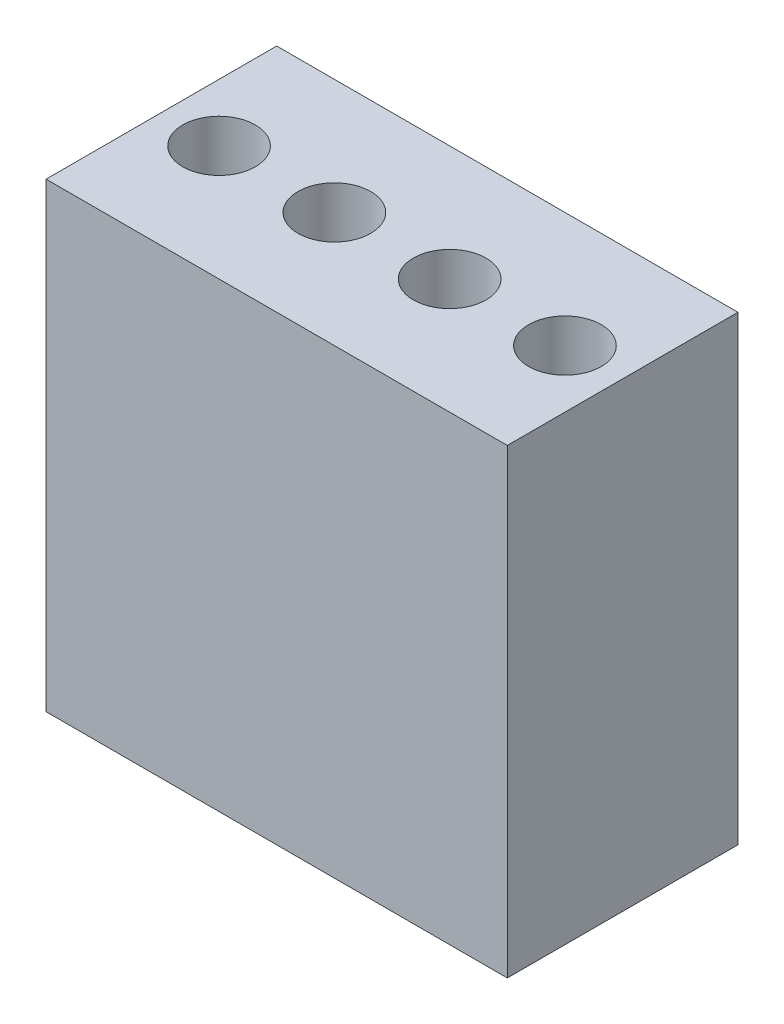
from build123d import *

# Parameters (mm, degrees)
SKETCH1_W           = 12.7
SKETCH1_H           = 6.35
SKETCH1_R           = 1
BOSS_EXTRUDE1_DEPTH = 12.7


with BuildPart() as part:
    # Sketch1 → Boss-Extrude1 (new body)
    with BuildSketch(Plane(origin=(0, 0, 0), x_dir=(1, 0, 0), z_dir=(0, 1, 0))):
        with Locations((6.35, 3.175)):
            Rectangle(SKETCH1_W, SKETCH1_H)
        with Locations(Location((1.5875, 3.175, 0), (0, 0, 270))):
            Circle(SKETCH1_R, mode=Mode.SUBTRACT)
        with Locations(Location((4.7625, 3.175, 0), (0, 0, 270))):
            Circle(SKETCH1_R, mode=Mode.SUBTRACT)
        with Locations(Location((7.9375, 3.175, 0), (0, 0, 270))):
            Circle(SKETCH1_R, mode=Mode.SUBTRACT)
        with Locations(Location((11.1125, 3.175, 0), (0, 0, 270))):
            Circle(SKETCH1_R, mode=Mode.SUBTRACT)
    extrude(amount=BOSS_EXTRUDE1_DEPTH)


solid = part.part
